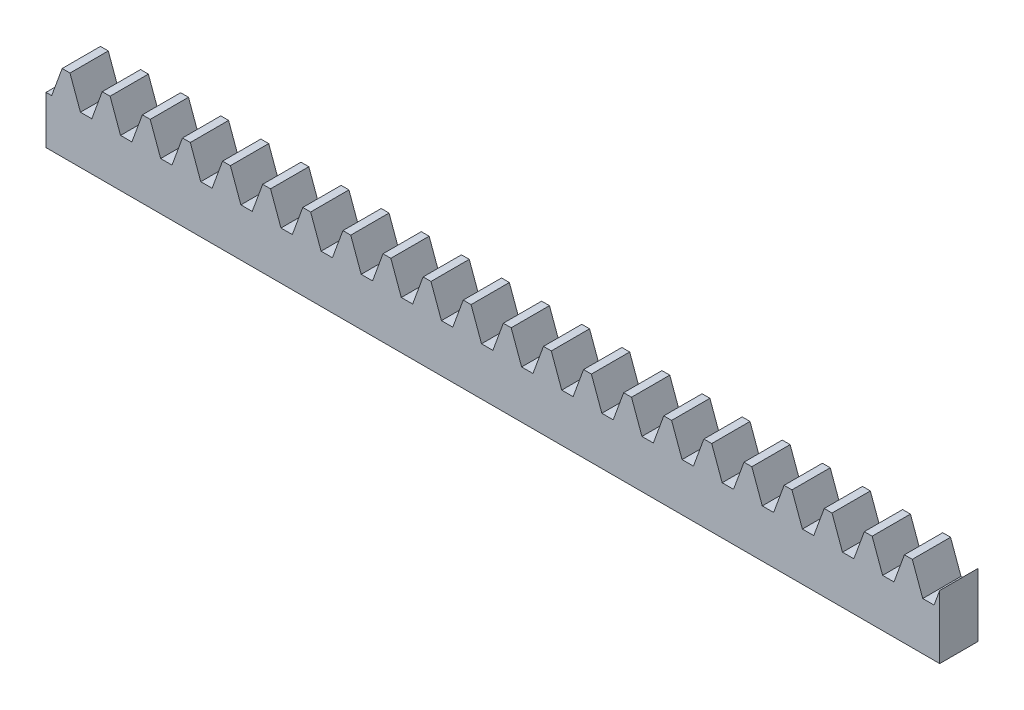
from build123d import *

# Parameters (mm, degrees)
BLANKSKE_W        = 70
BLANKSKE_H        = 6
BLANK_DEPTH       = 3
TOOTHCUTSIM_DEPTH = 71.320693967
TEETHCUTS_COUNT   = 24
TEETHCUTS_PITCH   = 3.14159265


with BuildPart() as part:
    # BlankSke → Blank (new body)
    with BuildSketch(Plane.XY):
        with Locations((35, 3)):
            Rectangle(BLANKSKE_W, BLANKSKE_H)
    extrude(amount=-BLANK_DEPTH)

    # TooCutSkeSim → ToothCutSim (cut, through all)
    with BuildSketch(Plane.XY):
        Polygon((0.44443537, 3.75), (-0.44443537, 3.75), (-1.272613241, 6.0254), (1.272613241, 6.0254), align=None)
    toothcutsim = extrude(amount=-TOOTHCUTSIM_DEPTH, mode=Mode.SUBTRACT)

    # TeethCuts: ToothCutSim ×24
    with Locations(*[(i * TEETHCUTS_PITCH, 0, 0) for i in range(1, TEETHCUTS_COUNT)]):
        add(toothcutsim, mode=Mode.SUBTRACT)


solid = part.part
